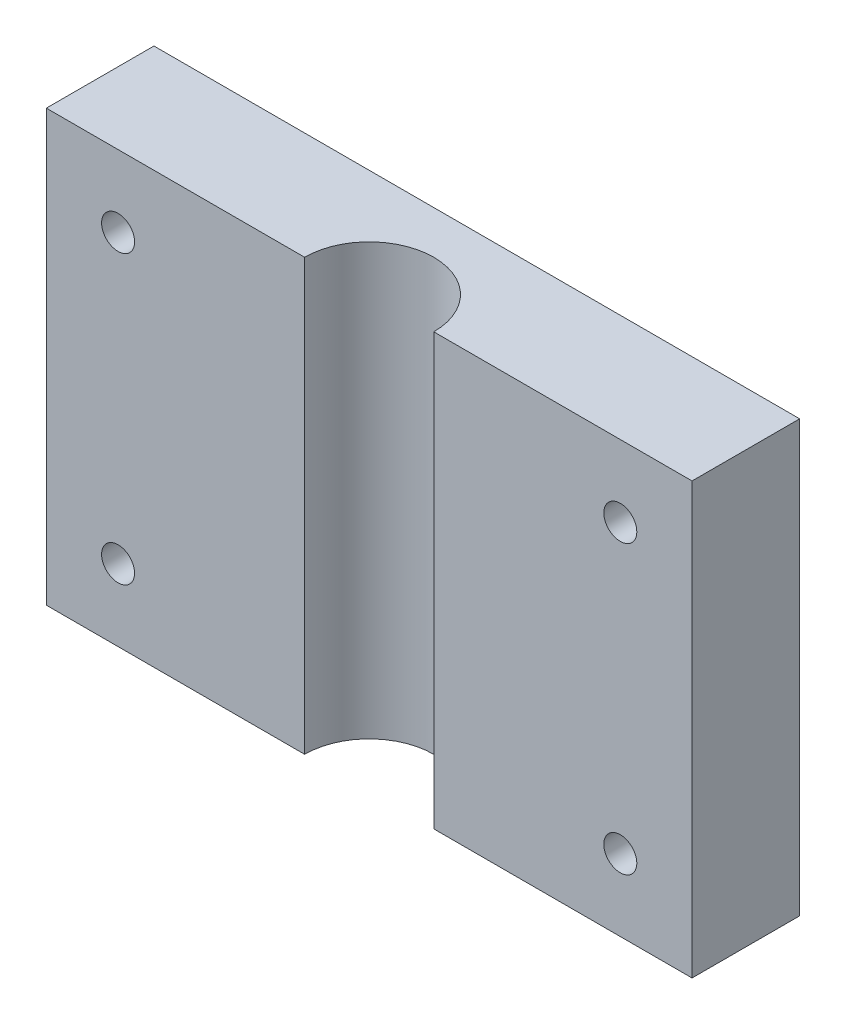
from build123d import *

# Parameters (mm, degrees)
SKETCH1_W           = 90
SKETCH1_H           = 60
SKETCH1_R           = 2.3
BOSS_EXTRUDE1_DEPTH = 15
SKETCH2_R           = 9
CUT_EXTRUDE1_DEPTH  = 72


with BuildPart() as part:
    # Sketch1 → Boss-Extrude1 (new body)
    with BuildSketch(Plane.XY):
        Rectangle(SKETCH1_W, SKETCH1_H)
        with Locations((-35, -20)):
            Circle(SKETCH1_R, mode=Mode.SUBTRACT)
        with Locations(Location((35, -20, 0), (0, 0, 180))):
            Circle(SKETCH1_R, mode=Mode.SUBTRACT)
        with Locations((35, 20)):
            Circle(SKETCH1_R, mode=Mode.SUBTRACT)
        with Locations(Location((-35, 20, 0), (0, 0, 180))):
            Circle(SKETCH1_R, mode=Mode.SUBTRACT)
    extrude(amount=BOSS_EXTRUDE1_DEPTH)

    # Sketch2 → Cut-Extrude1 (cut)
    with BuildSketch(Plane.XZ.offset(30)):
        with Locations((0, 15)):
            Circle(SKETCH2_R)
    extrude(amount=-CUT_EXTRUDE1_DEPTH, mode=Mode.SUBTRACT)


solid = part.part
